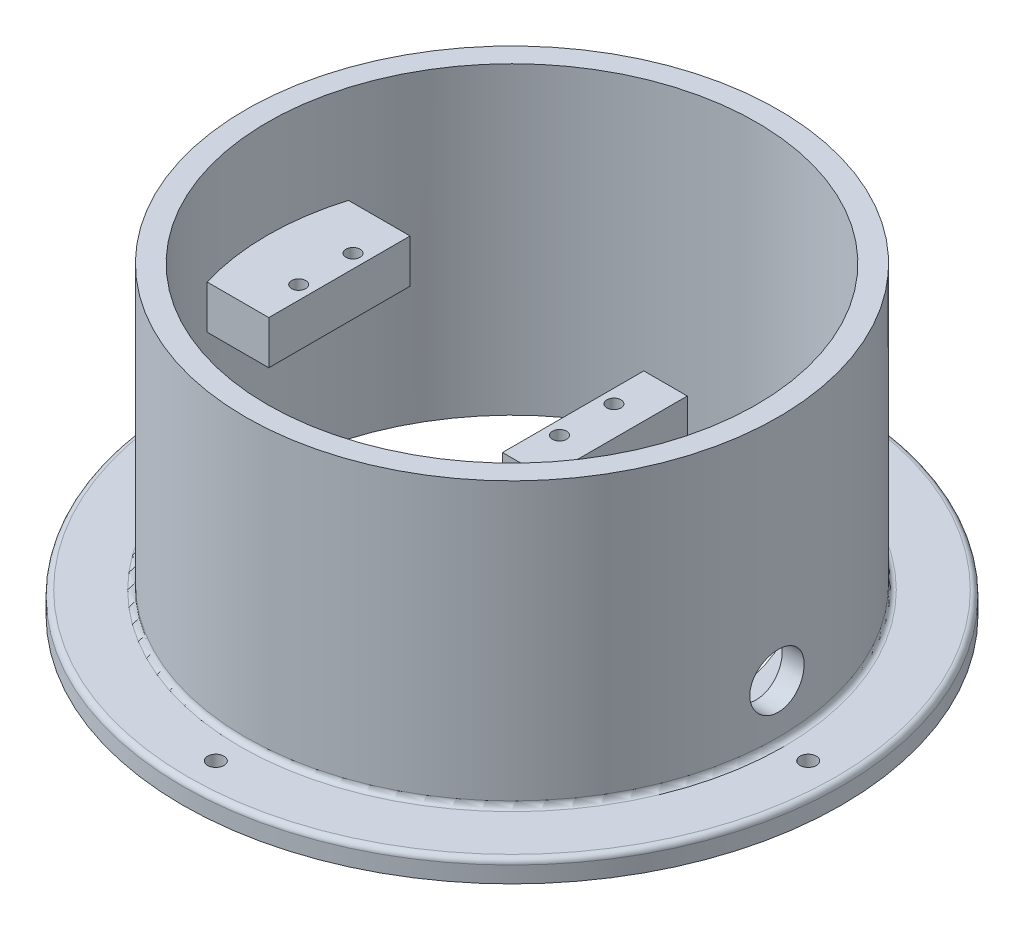
from build123d import *

# Parameters (mm, degrees)
SKETCH1_R           = 60.625
SKETCH1_R_2         = 45
BOSS_EXTRUDE2_DEPTH = 4
SKETCH2_R           = 49
SKETCH2_R_2         = 45
BOSS_EXTRUDE3_DEPTH = 52
SKETCH3_W           = 8
SKETCH3_H           = 38
SKETCH3_W_2         = 15
SKETCH3_H_2         = 8
BOSS_EXTRUDE5_DEPTH = 13
SKETCH4_W           = 10
SKETCH4_H           = 24
CUT_EXTRUDE1_DEPTH  = 8
SKETCH5_R           = 5
CUT_EXTRUDE2_DEPTH  = 110.441337026
SKETCH7_R           = 1.3
CUT_EXTRUDE3_DEPTH  = 7.2
BOSS_EXTRUDE6_DEPTH = 4
SKETCH9_R           = 1.5
CUT_EXTRUDE4_DEPTH  = 103.404986506
FILLET1_R           = 1


with BuildPart() as part:
    # Sketch1 → Boss-Extrude2 (new body)
    with BuildSketch(Plane(origin=(0, 0, 0), x_dir=(1, 0, 0), z_dir=(0, 1, 0))):
        with Locations(Location((0, 0, 0), (0, 0, 270))):
            Circle(SKETCH1_R)
        with Locations(Location((0, 0, 0), (0, 0, 270))):
            Circle(SKETCH1_R_2, mode=Mode.SUBTRACT)
    extrude(amount=BOSS_EXTRUDE2_DEPTH)

    # Sketch2 → Boss-Extrude3 (add)
    with BuildSketch(Plane(origin=(0, 4, 0), x_dir=(1, 0, 0), z_dir=(0, 1, 0))):
        with Locations(Location((0, 0, 0), (0, 0, 90))):
            Circle(SKETCH2_R)
        with Locations(Location((0, 0, 0), (0, 0, 270))):
            Circle(SKETCH2_R_2, mode=Mode.SUBTRACT)
    extrude(amount=BOSS_EXTRUDE3_DEPTH)

    # Sketch3 → Boss-Extrude5 (add, symmetric)
    with BuildSketch(Plane.XY):
        with Locations((15.25, 19)):
            Rectangle(SKETCH3_W, SKETCH3_H)
        with Locations((-39.25, 34)):
            Rectangle(SKETCH3_W_2, SKETCH3_H_2)
    extrude(amount=BOSS_EXTRUDE5_DEPTH, both=True)


with BuildPart() as boss_extrude5_piece_1:
    # of the separate pieces the step leaves, piece 1, a body of its own (boss_extrude5_pieces)
    add(part.part.solids().sort_by_distance((0, 0, 60.625))[0])

    # Sketch5 → Cut-Extrude2 (cut, through all)
    with BuildSketch(Plane.ZY.offset(-11.25)):
        with Locations((0, 14)):
            Circle(SKETCH5_R)
    extrude(amount=-CUT_EXTRUDE2_DEPTH, mode=Mode.SUBTRACT)


with BuildPart() as boss_extrude5_piece_2:
    # of the separate pieces the step leaves, piece 2, a body of its own (boss_extrude5_pieces)
    add(part.part.solids().sort_by_distance((11.25, 0, -13))[0])

    # Sketch4 → Cut-Extrude1 (cut)
    with BuildSketch(Plane.ZY.offset(-11.25)):
        with Locations((0, 17)):
            Rectangle(SKETCH4_W, SKETCH4_H)
    extrude(amount=-CUT_EXTRUDE1_DEPTH, mode=Mode.SUBTRACT)


with BuildPart() as cut_extrude3_tool:
    # Sketch7 → Cut-Extrude3 (new body)
    with BuildSketch(Plane(origin=(0, 38, 0), x_dir=(1, 0, 0), z_dir=(0, 1, 0))):
        with Locations(Location((-34.25, 5, 0), (0, 0, 270))):
            Circle(SKETCH7_R)
        with Locations(Location((-34.25, -5, 0), (0, 0, 270))):
            Circle(SKETCH7_R)
        with Locations(Location((13.75, 5, 0), (0, 0, 270))):
            Circle(SKETCH7_R)
        with Locations(Location((13.75, -5, 0), (0, 0, 270))):
            Circle(SKETCH7_R)
    extrude(amount=-CUT_EXTRUDE3_DEPTH)


with BuildPart() as boss_extrude5_piece_1_1:
    add(boss_extrude5_piece_1.part)

    # Cut-Extrude3: cut by cut_extrude3_tool
    add(cut_extrude3_tool.part, mode=Mode.SUBTRACT)



with BuildPart() as boss_extrude5_piece_2_1:
    add(boss_extrude5_piece_2.part)

    # Cut-Extrude3: cut by cut_extrude3_tool
    add(cut_extrude3_tool.part, mode=Mode.SUBTRACT)


with BuildPart() as boss_extrude5_piece_1_2:
    add(boss_extrude5_piece_1_1.part)

    add(boss_extrude5_piece_2_1.part)  # Boss-Extrude6 merges Boss-Extrude5 piece 2
    # Sketch8 → Boss-Extrude6 (add)
    with BuildSketch(Plane.XZ):
        with BuildLine():
            Line((11.25, 13), (25.249838503, 37.248431585))
            ThreePointArc((25.249838503, 37.248431585), (45, 0), (25.249838503, -37.248431585))
            Line((25.249838503, -37.248431585), (11.25, -13))
            Line((11.25, -13), (11.25, 13))
        make_face()
        with BuildLine():
            Line((24.25, 19.516660498), (27.361802413, 24.906460381))
            ThreePointArc((27.361802413, 24.906460381), (37, 0), (27.361802413, -24.906460381))
            Line((27.361802413, -24.906460381), (24.25, -19.516660498))
            Line((24.25, -19.516660498), (24.25, 19.516660498))
        make_face(mode=Mode.SUBTRACT)
    extrude(amount=-BOSS_EXTRUDE6_DEPTH)

    # Sketch9 → Cut-Extrude4 (cut, through all)
    with BuildSketch(Plane.XZ):
        with Locations(Location((54.5, 0, 0), (0, 0, 270))):
            Circle(SKETCH9_R)
        with Locations(Location((0, -54.5, 0), (0, 0, 270))):
            Circle(SKETCH9_R)
        with Locations(Location((-54.5, 0, 0), (0, 0, 270))):
            Circle(SKETCH9_R)
        with Locations(Location((0, 54.5, 0), (0, 0, 270))):
            Circle(SKETCH9_R)
    extrude(amount=-CUT_EXTRUDE4_DEPTH, mode=Mode.SUBTRACT)

    # Fillet1
    fillet1_edges = [boss_extrude5_piece_1_2.edges().sort_by_distance(p)[0] for p in [
        (0, 4, -60.625),
        (0, 4, 49),
    ]]
    fillet(fillet1_edges, radius=FILLET1_R)


solid = boss_extrude5_piece_1_2.part
